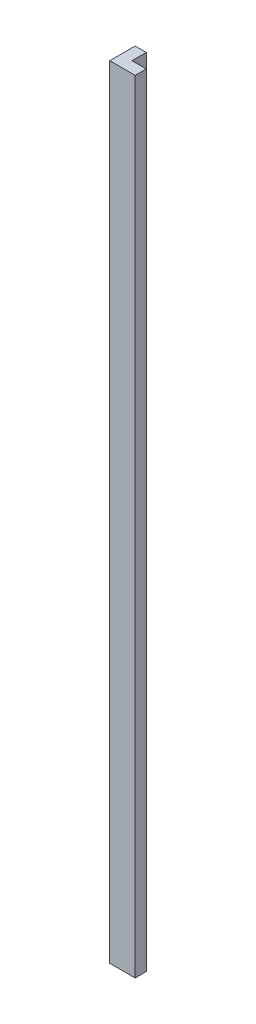
from build123d import *

# Parameters (mm, degrees)
BOSS_EXTRUDE1_DEPTH = 7124.7


with BuildPart() as part:
    # Sketch1 → Boss-Extrude1 (new body)
    with BuildSketch(Plane(origin=(0, 0, 0), x_dir=(1, 0, 0), z_dir=(0, 1, 0))):
        Polygon((0, 0), (0, 231.775), (101.6, 231.775), (101.6, 101.6), (231.775, 101.6), (231.775, 0), align=None)
    extrude(amount=BOSS_EXTRUDE1_DEPTH)


solid = part.part
